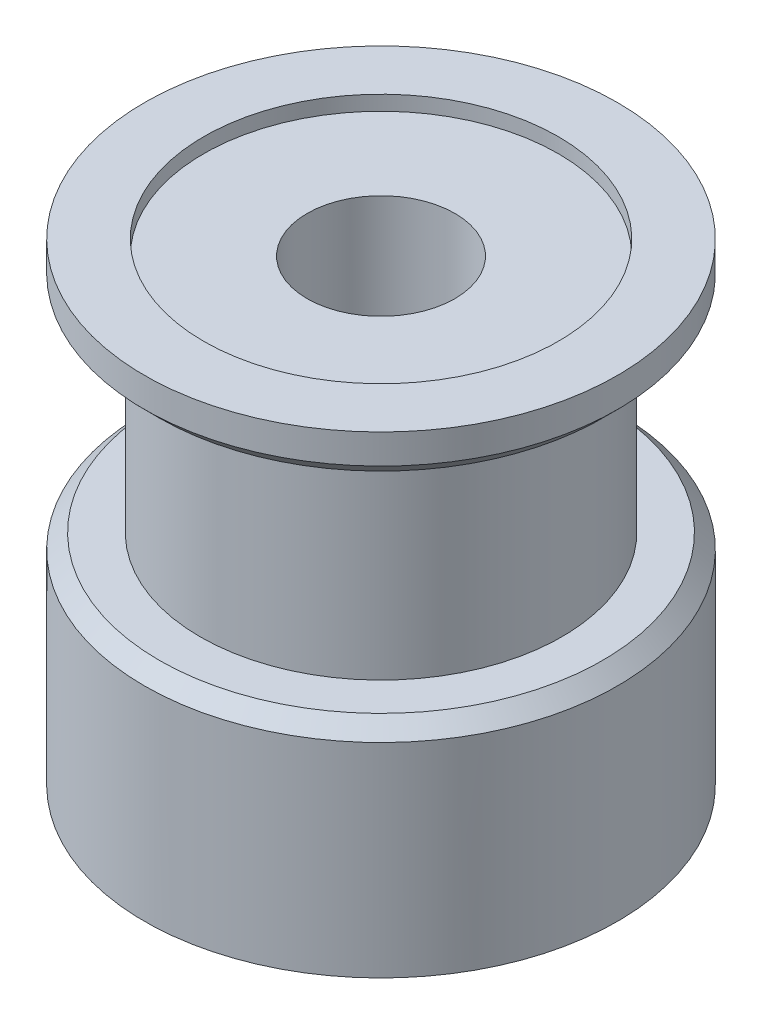
from build123d import *

# Parameters (mm, degrees)
CHAMFER1_SIZE      = 0.5
SKETCH2_R          = 6
CUT_EXTRUDE1_DEPTH = 0.5


with BuildPart() as part:
    # Sketch1 → Revolve1 (revolve)
    with BuildSketch(Plane.XY, mode=Mode.PRIVATE) as revolve1_sk:
        Polygon((2.5, 0), (2.5, 16), (8, 16), (8, 14.5), (6.12, 14.5), (6.12, 7.4), (8, 7.4), (8, 0), align=None)
    revolve(revolve1_sk.sketch.rotate(Axis((0, 0, 0), (0, 1, 0)), 90), axis=Axis((0, 0, 0), (0, 1, 0)))

    # Chamfer1
    chamfer1_edges = [part.edges().sort_by_distance(p)[0] for p in [
        (0, 7.4, 8),
        (0, 14.5, 8),
    ]]
    chamfer(chamfer1_edges, length=CHAMFER1_SIZE)

    # Sketch2 → Cut-Extrude1 (cut)
    with BuildSketch(Plane(origin=(0, 16, 0), x_dir=(1, 0, 0), z_dir=(0, 1, 0))):
        with Locations(Location((0, 0, 0), (0, 0, 270))):
            Circle(SKETCH2_R)
    extrude(amount=-CUT_EXTRUDE1_DEPTH, mode=Mode.SUBTRACT)


solid = part.part
